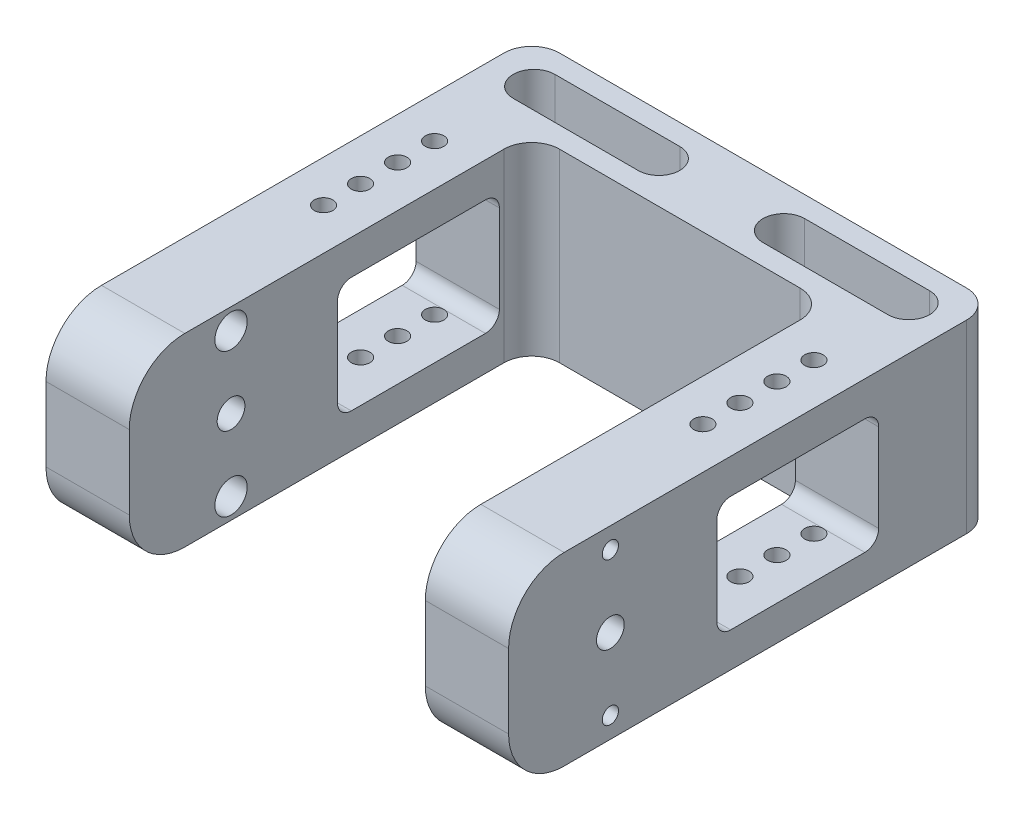
from build123d import *

# Parameters (mm, degrees)
EXTRUDE_1_DEPTH          = 20
SKETCH_2_R               = 3
SKETCH_2_R_2             = 1.75
CUT_EXTRUDE_1_DEPTH      = 112
CUT_EXTRUDE_2_DEPTH      = 123
CUT_EXTRUDE_2_DEPTH_BACK = 61
SKETCH_5_W               = 18
SKETCH_5_H               = 40
EXTRUDE_3_DEPTH          = 15
CUT_EXTRUDE_3_DEPTH      = 141.356688476
CUT_EXTRUDE_3_DEPTH_BACK = 141.356688476
SKETCH_6_R               = 2
CUT_EXTRUDE_4_DEPTH      = 141.356688476
CUT_EXTRUDE_4_DEPTH_BACK = 141.356688476
FILLET_1_R               = 6
FILLET_2_R               = 12
CUT_EXTRUDE_5_DEPTH      = 147.372811683
CUT_EXTRUDE_5_DEPTH_BACK = 3
SKETCH_8_W               = 15.6
SKETCH_8_H               = 15.6
SKETCH_9_R               = 3.5
CUT_EXTRUDE_6_DEPTH      = 45


with BuildPart() as part:
    # 草图1 → 凸台-拉伸1 (new, symmetric)
    with BuildSketch(Plane(origin=(0, 0, 0), x_dir=(1, 0, 0), z_dir=(0, 1, 0))):
        Polygon((-18, 0), (0, 0), (0, 90), (-100, 90), (-100, 0), (-82, 0), (-82, 72), (-18, 72), align=None)
    extrude(amount=EXTRUDE_1_DEPTH, both=True)

    # 草图2 → 切除-拉伸1 (cut)
    with BuildSketch(Plane.ZY.offset(100)):
        with Locations((-7, 0)):
            Circle(SKETCH_2_R)
        with Locations((-7, 15.5)):
            Circle(SKETCH_2_R_2)
        with Locations((-7, -15.5)):
            Circle(SKETCH_2_R_2)
    extrude(amount=-CUT_EXTRUDE_1_DEPTH, mode=Mode.SUBTRACT)

    # 草图4 → 切除-拉伸2 (cut, two sides: drawn at the far end of the back side and taken through both)
    with BuildSketch(Plane.ZY.offset(18).offset(-CUT_EXTRUDE_2_DEPTH_BACK)):
        with BuildLine():
            Line((-62, 12.5), (-33, 12.5))
            ThreePointArc((-33, 12.5), (-30.878679656, 11.621320344), (-30, 9.5))
            Line((-30, 9.5), (-30, -9.5))
            ThreePointArc((-30, -9.5), (-30.878679656, -11.621320344), (-33, -12.5))
            Line((-33, -12.5), (-62, -12.5))
            ThreePointArc((-62, -12.5), (-64.121320344, -11.621320344), (-65, -9.5))
            Line((-65, -9.5), (-65, 9.5))
            ThreePointArc((-65, 9.5), (-64.121320344, 11.621320344), (-62, 12.5))
        make_face()
    extrude(amount=CUT_EXTRUDE_2_DEPTH + CUT_EXTRUDE_2_DEPTH_BACK, mode=Mode.SUBTRACT)

    # 草图5 → 凸台-拉伸3 (add)
    with BuildSketch(Plane.XY):
        with Locations((-9, 0)):
            Rectangle(SKETCH_5_W, SKETCH_5_H)
        with Locations((-91, 0)):
            Rectangle(SKETCH_5_W, SKETCH_5_H)
    extrude(amount=EXTRUDE_3_DEPTH)

    # 草图6 → 切除-拉伸3 (cut, two sides: drawn at the far end of the back side and taken through both)
    with BuildSketch(Plane(origin=(0, 20, 0), x_dir=(1, 0, 0), z_dir=(0, 1, 0)).offset(-CUT_EXTRUDE_3_DEPTH_BACK)):
        with Locations(Location((-91, 60, 0), (0, 0, 270))):
            Circle(SKETCH_6_R)
        with Locations(Location((-91, 52, 0), (0, 0, 270))):
            Circle(SKETCH_6_R)
        with Locations(Location((-91, 44, 0), (0, 0, 270))):
            Circle(SKETCH_6_R)
        with Locations(Location((-91, 36, 0), (0, 0, 270))):
            Circle(SKETCH_6_R)
        with Locations(Location((-9, 36, 0), (0, 0, 270))):
            Circle(SKETCH_6_R)
        with Locations(Location((-9, 44, 0), (0, 0, 270))):
            Circle(SKETCH_6_R)
        with Locations(Location((-9, 52, 0), (0, 0, 270))):
            Circle(SKETCH_6_R)
        with Locations(Location((-9, 60, 0), (0, 0, 90))):
            Circle(SKETCH_6_R)
    extrude(amount=CUT_EXTRUDE_3_DEPTH + CUT_EXTRUDE_3_DEPTH_BACK, mode=Mode.SUBTRACT)

    # 草图7 → 切除-拉伸4 (cut, two sides: drawn at the far end of the back side and taken through both)
    with BuildSketch(Plane(origin=(0, 20, 0), x_dir=(1, 0, 0), z_dir=(0, 1, 0)).offset(-CUT_EXTRUDE_4_DEPTH_BACK)):
        with BuildLine():
            Line((-90.5, 85.5), (-63.5, 85.5))
            ThreePointArc((-63.5, 85.5), (-59, 81), (-63.5, 76.5))
            Line((-63.5, 76.5), (-90.5, 76.5))
            ThreePointArc((-90.5, 76.5), (-95, 81), (-90.5, 85.5))
        make_face()
        with BuildLine():
            Line((-9.5, 85.5), (-36.5, 85.5))
            ThreePointArc((-36.5, 85.5), (-41, 81), (-36.5, 76.5))
            Line((-36.5, 76.5), (-9.5, 76.5))
            ThreePointArc((-9.5, 76.5), (-5, 81), (-9.5, 85.5))
        make_face()
    extrude(amount=CUT_EXTRUDE_4_DEPTH + CUT_EXTRUDE_4_DEPTH_BACK, mode=Mode.SUBTRACT)

    # 圆角1
    fillet_1_edges = [part.edges().sort_by_distance(p)[0] for p in [
        (-18, 0, -72),
        (-82, 0, -72),
        (-100, 0, -90),
        (0, 0, -90),
    ]]
    fillet(fillet_1_edges, radius=FILLET_1_R)

    # 圆角2
    fillet_2_edges = [part.edges().sort_by_distance(p)[0] for p in [
        (-9, -20, 15),
        (-9, 20, 15),
        (-91, -20, 15),
        (-91, 20, 15),
    ]]
    fillet(fillet_2_edges, radius=FILLET_2_R)

    # 草图8 → 切除-拉伸5 (cut, two sides: drawn at the far end of the back side and taken through both)
    with BuildSketch(Plane(origin=(0, 0, -90), x_dir=(-1, 0, 0), z_dir=(0, 0, -1)).offset(-CUT_EXTRUDE_5_DEPTH_BACK)):
        with Locations((50, 0)):
            Rectangle(SKETCH_8_W, SKETCH_8_H)
    extrude(amount=CUT_EXTRUDE_5_DEPTH + CUT_EXTRUDE_5_DEPTH_BACK, mode=Mode.SUBTRACT)

    # 草图9 → 切除-拉伸6 (cut, symmetric)
    with BuildSketch(Plane.ZY.offset(50)):
        with Locations((-7, 15.5)):
            Circle(SKETCH_9_R)
        with Locations((-7, -15.5)):
            Circle(SKETCH_9_R)
    extrude(amount=CUT_EXTRUDE_6_DEPTH, both=True, mode=Mode.SUBTRACT)


solid = part.part
